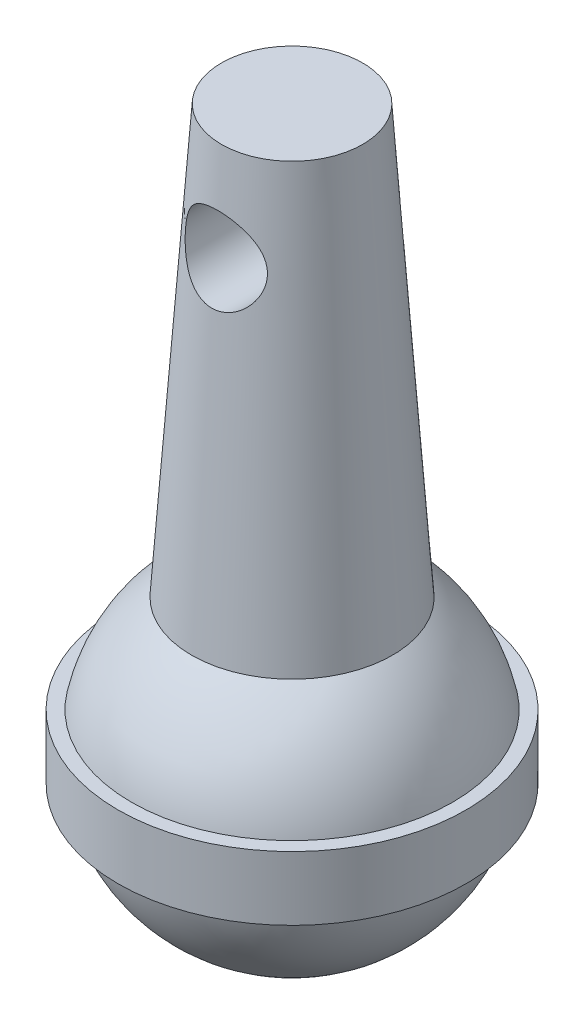
from build123d import *

# Parameters (mm, degrees)
ESQUISSE10_R                 = 13.380418928
BOSS_EXTRU_1_DEPTH           = 68
BOSS_EXTRU_1_TAPER           = 4
ENL_V_MAT_EXTRU_1_DEPTH      = 68
ENL_V_MAT_EXTRU_1_DEPTH_BACK = 68
ESQUISSE11_R                 = 5
ESQUISSE12_W                 = 2.496707964
ESQUISSE12_H                 = 7.80736829


with BuildPart() as part:
    # Esquisse1 → Révolution1 (revolve)
    with BuildSketch(Plane.XY):
        with BuildLine():
            Line((0, 20), (0, -20))
            ThreePointArc((0, -20), (-20, 0), (0, 20))
        make_face()
    revolve(axis=Axis((0, 20, 0), (0, -1, 0)))

    # Esquisse10 → Boss.-Extru.1 (add)
    with BuildSketch(Plane(origin=(0, 0, 0), x_dir=(1, 0, 0), z_dir=(0, 1, 0))):
        Circle(ESQUISSE10_R)
    extrude(amount=BOSS_EXTRU_1_DEPTH, taper=BOSS_EXTRU_1_TAPER)

    # Esquisse11 → Enlèv. mat.-Extru.1 (cut, two sides: drawn at the far end of the back side and taken through both)
    with BuildSketch(Plane.XY.offset(-ENL_V_MAT_EXTRU_1_DEPTH_BACK)):
        with Locations((0, 56.262547548)):
            Circle(ESQUISSE11_R)
    extrude(amount=ENL_V_MAT_EXTRU_1_DEPTH + ENL_V_MAT_EXTRU_1_DEPTH_BACK, mode=Mode.SUBTRACT)

    # Balayage1: sweep along a path in Esquisse19
    with BuildLine(Plane(origin=(0, 0, 0), x_dir=(1, 0, 0), z_dir=(0, 1, 0))) as balayage1_path:
        CenterArc((0, 0), 20, 0, 360)
    # Esquisse12 → Balayage1 (sweep)
    with BuildSketch(Plane(origin=(0, 0, 0), x_dir=(0, 0, -1), z_dir=(1, 0, 0))):
        with Locations((-20, 0)):
            Rectangle(ESQUISSE12_W, ESQUISSE12_H)
    sweep(path=balayage1_path.line)


solid = part.part
